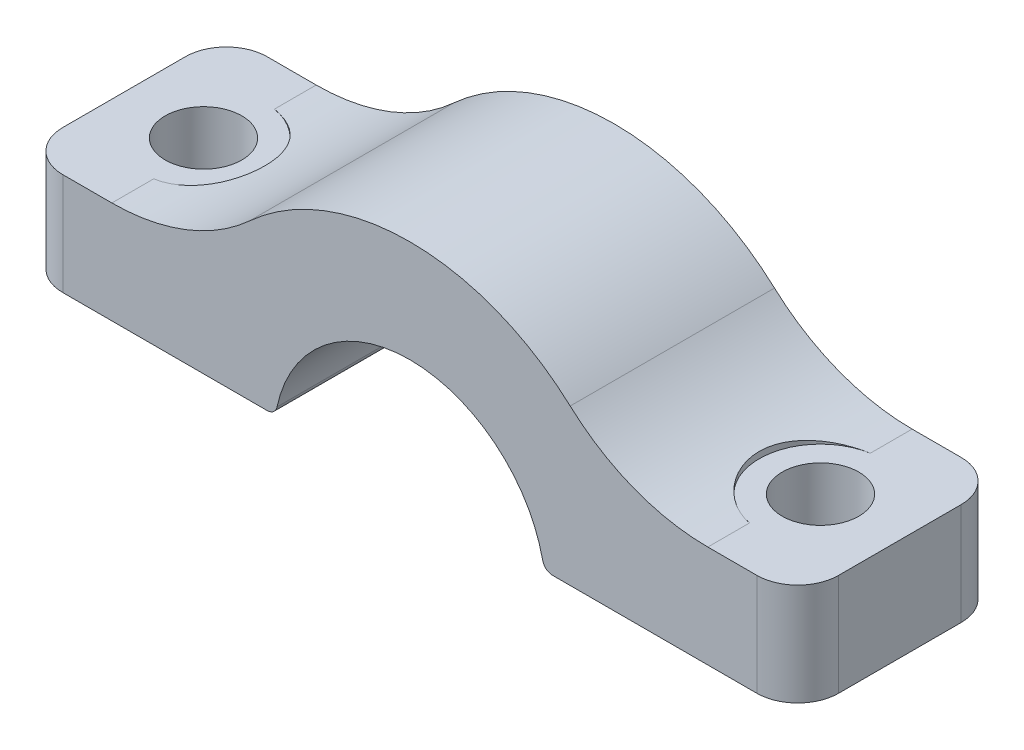
from build123d import *

# Parameters (mm, degrees)
BOSS_EXTRUDE1_DEPTH = 10
FILLET1_R           = 2
FILLET3_R           = 0.5
FILLET4_R           = 10
SKETCH2_R           = 1.875
CUT_EXTRUDE1_DEPTH  = 25.417106227
CUT_EXTRUDE2_START  = 6
SKETCH3_R           = 3
CUT_EXTRUDE2_DEPTH  = 10


with BuildPart() as part:
    # Sketch1 → Boss-Extrude1 (new body)
    with BuildSketch(Plane.XY):
        with BuildLine():
            Line((-18.986115361, 1), (-6.5743821, 1))
            ThreePointArc((-6.5743821, 1), (0, 6.65), (6.5743821, 1))
            Line((6.5743821, 1), (18.986115361, 1))
            Line((18.986115361, 1), (18.986115361, 6))
            Line((18.986115361, 6), (9.986115361, 6))
            ThreePointArc((9.986115361, 6), (0, 11.65), (-9.986115361, 6))
            Line((-9.986115361, 6), (-18.986115361, 6))
            Line((-18.986115361, 6), (-18.986115361, 1))
        make_face()
    extrude(amount=BOSS_EXTRUDE1_DEPTH)

    # Fillet1
    fillet1_edges = [part.edges().sort_by_distance(p)[0] for p in [
        (-18.986115361, 3.5, 0),
        (18.986115361, 3.5, 10),
        (-18.986115361, 3.5, 10),
        (18.986115361, 3.5, 0),
    ]]
    fillet(fillet1_edges, radius=FILLET1_R)

    # Fillet3
    fillet3_edges = [part.edges().sort_by_distance(p)[0] for p in [
        (6.5743821, 1, 5),
        (-6.5743821, 1, 5),
    ]]
    fillet(fillet3_edges, radius=FILLET3_R)

    # Fillet4
    fillet4_edges = [part.edges().sort_by_distance(p)[0] for p in [
        (-9.986115361, 6, 5),
        (9.986115361, 6, 5),
    ]]
    fillet(fillet4_edges, radius=FILLET4_R)

    # Sketch2 → Cut-Extrude1 (cut, through all)
    with BuildSketch(Plane(origin=(0, 0, 0), x_dir=(1, 0, 0), z_dir=(0, 1, 0))):
        with Locations(Location((-15.1, -5, 0), (0, 0, 74.058148942))):
            Circle(SKETCH2_R)
        with Locations(Location((15.1, -5, 0), (0, 0, 105.941851061))):
            Circle(SKETCH2_R)
    extrude(amount=CUT_EXTRUDE1_DEPTH, mode=Mode.SUBTRACT)

    # Sketch3 → Cut-Extrude2 (cut)
    with BuildSketch(Plane(origin=(0, 0, 0), x_dir=(1, 0, 0), z_dir=(0, 1, 0)).offset(CUT_EXTRUDE2_START)):
        with Locations((-15.1, -5)):
            Circle(SKETCH3_R)
        with Locations((15.1, -5)):
            Circle(SKETCH3_R)
    extrude(amount=CUT_EXTRUDE2_DEPTH, mode=Mode.SUBTRACT)


solid = part.part
